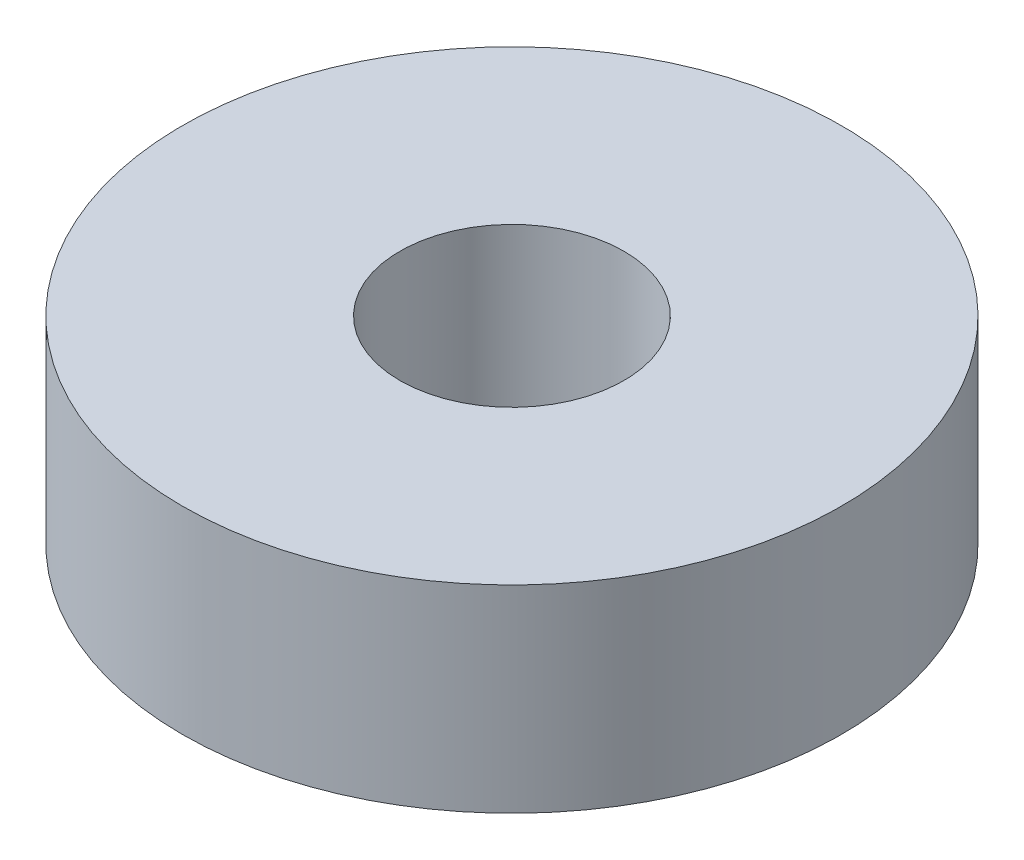
from build123d import *

# Parameters (mm, degrees)
SKETCH_1_R          = 2.5
EXTRUDE_1_DEPTH     = 1.5
SKETCH_2_R          = 0.85
CUT_EXTRUDE_1_DEPTH = 4.840572874


with BuildPart() as part:
    # 草图1 → 凸台-拉伸1 (new body)
    with BuildSketch(Plane(origin=(0, 0, 0), x_dir=(1, 0, 0), z_dir=(0, 1, 0))):
        with Locations(Location((0, 0, 0), (0, 0, 270))):
            Circle(SKETCH_1_R)
    extrude(amount=EXTRUDE_1_DEPTH)

    # 草图2 → 切除-拉伸1 (cut, through all)
    with BuildSketch(Plane(origin=(0, 1.5, 0), x_dir=(1, 0, 0), z_dir=(0, 1, 0))):
        with Locations(Location((0, 0, 0), (0, 0, 270))):
            Circle(SKETCH_2_R)
    extrude(amount=-CUT_EXTRUDE_1_DEPTH, mode=Mode.SUBTRACT)


solid = part.part
